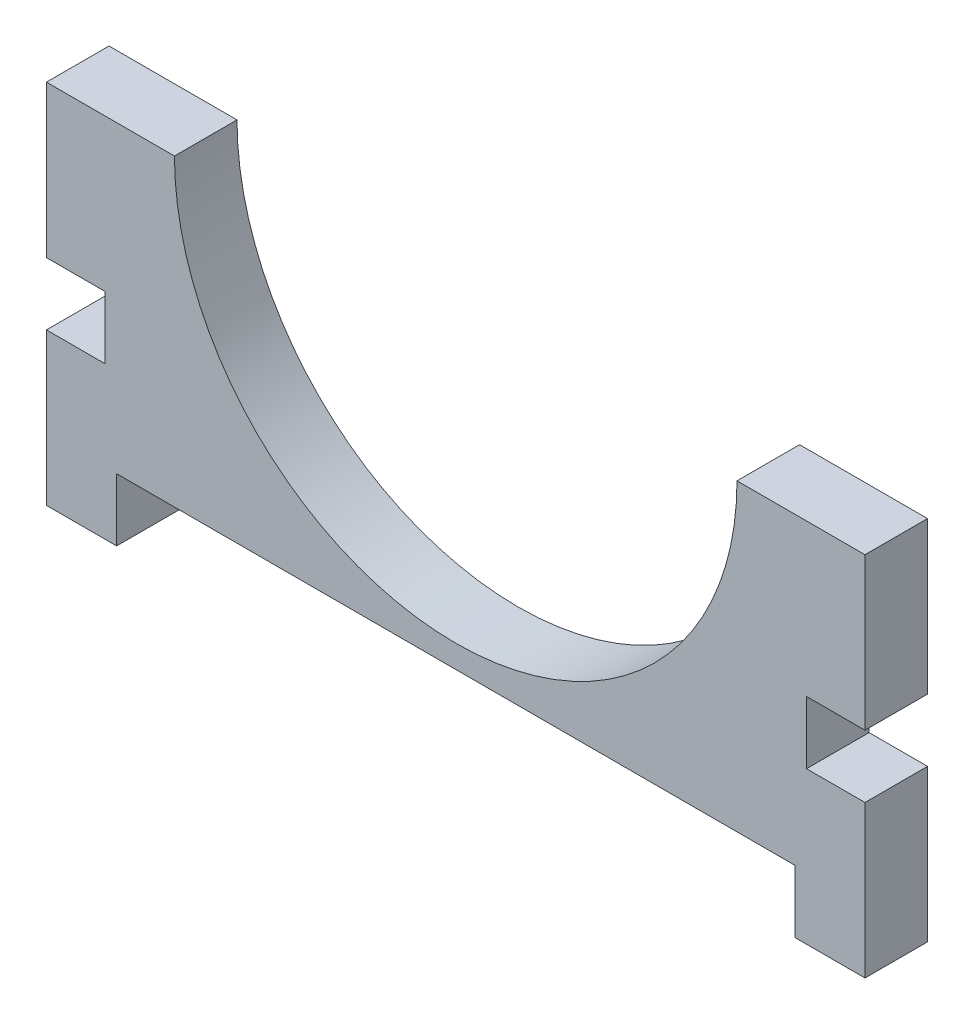
from build123d import *

# Parameters (mm, degrees)
BOSS_EXTRUDE1_DEPTH = 5.35


with BuildPart() as part:
    # Model → Boss-Extrude1 (new body)
    with BuildSketch(Plane.XY):
        with BuildLine():
            Line((-35, 13), (-35, 26))
            Line((-35, 26), (-24.055, 26))
            ThreePointArc((-24.055, 26), (0, 1.945), (24.055, 26))
            Line((24.055, 26), (35, 26))
            Line((35, 26), (35, 13))
            Line((35, 13), (30, 13))
            Line((30, 13), (30, 7.65))
            Line((30, 7.65), (35, 7.65))
            Line((35, 7.65), (35, -5.317542305))
            Line((35, -5.317542305), (35, -5.35))
            Line((35, -5.35), (29, -5.35))
            Line((29, -5.35), (29, 0))
            Line((29, 0), (-29, 0))
            Line((-29, 0), (-29, -5.35))
            Line((-29, -5.35), (-35, -5.35))
            Line((-35, -5.35), (-35, -5.317542305))
            Line((-35, -5.317542305), (-35, 7.65))
            Line((-35, 7.65), (-30, 7.65))
            Line((-30, 7.65), (-30, 13))
            Line((-30, 13), (-35, 13))
        make_face()
    extrude(amount=BOSS_EXTRUDE1_DEPTH)


solid = part.part
